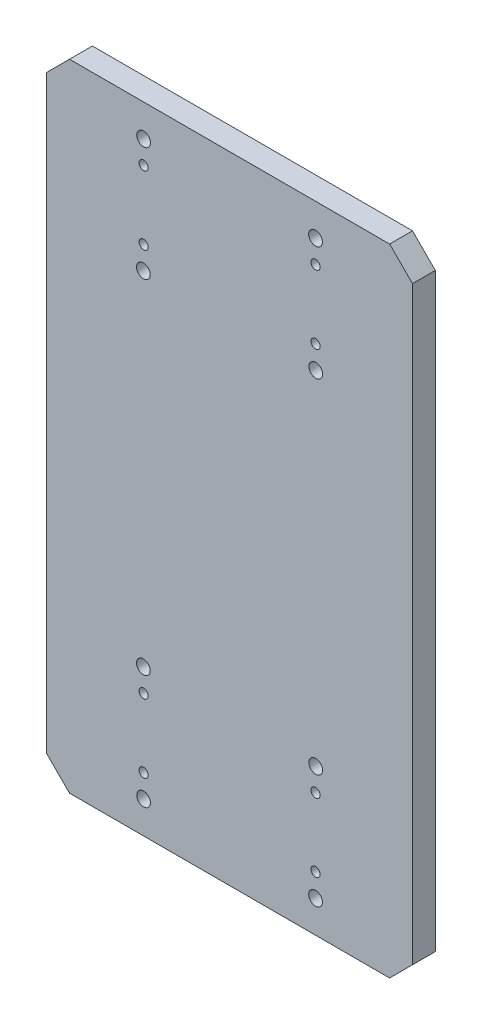
from build123d import *

# Parameters (mm, degrees)
SKETCH1_W                = 80
SKETCH1_H                = 139
BOSS_EXTRUDE1_DEPTH      = 5
F_3_0_3_DIAMETER_HOLE1_D = 3
F_2_0_2_DIAMETER_HOLE1_D = 2
CHAMFER1_SIZE            = 1.5
CHAMFER1_SIZE2           = 1.787630389
CHAMFER2_SIZE            = 5


with BuildPart() as part:
    # Sketch1 → Boss-Extrude1 (new body)
    with BuildSketch(Plane.XY.offset(5)):
        Rectangle(SKETCH1_W, SKETCH1_H)
    extrude(amount=-BOSS_EXTRUDE1_DEPTH)

    # Ø3.0 (3) Diameter Hole1 (through all)
    with Locations(Plane(origin=(0, 0, 0), x_dir=(-1, 0, 0), z_dir=(0, 0, -1))):
        with Locations((-18.8, 62.5), (18.8, -62.5), (-18.84545318, -37.5), (18.84545318, -37.5), (18.8, 62.5), (-18.84545318, 37.5), (18.84545318, 37.5), (-18.8, -62.5)):
            Hole(F_3_0_3_DIAMETER_HOLE1_D / 2)

    # Ø2.0 (2) Diameter Hole1 (through all)
    with Locations(Plane(origin=(0, 0, 0), x_dir=(-1, 0, 0), z_dir=(0, 0, -1))):
        with Locations((-18.8, 42.5), (-18.8, 57.5), (18.8, 42.5), (-18.8, -57.5), (-18.8, -42.5), (18.8, -57.5), (18.8, -42.5), (18.8, 57.5)):
            Hole(F_2_0_2_DIAMETER_HOLE1_D / 2)

    # Chamfer1
    chamfer1_edges = [part.edges().sort_by_distance(p)[0] for p in [
        (17.3, -62.5, 0),
        (-20.34545318, 37.5, 0),
        (17.34545318, 37.5, 0),
        (-20.3, 62.5, 0),
        (-20.34545318, -37.5, 0),
        (17.34545318, -37.5, 0),
        (-20.3, -62.5, 0),
        (17.3, 62.5, 0),
    ]]
    chamfer1_side = [part.faces().sort_by_distance(p)[0] for p in [
        (0, 0, 0),
    ]]
    chamfer(chamfer1_edges, length=CHAMFER1_SIZE, length2=CHAMFER1_SIZE2, reference=chamfer1_side[0])

    # Chamfer2
    chamfer2_edges = [part.edges().sort_by_distance(p)[0] for p in [
        (-40, 69.5, 2.5),
        (40, 69.5, 2.5),
        (40, -69.5, 2.5),
        (-40, -69.5, 2.5),
    ]]
    chamfer(chamfer2_edges, length=CHAMFER2_SIZE)


solid = part.part
